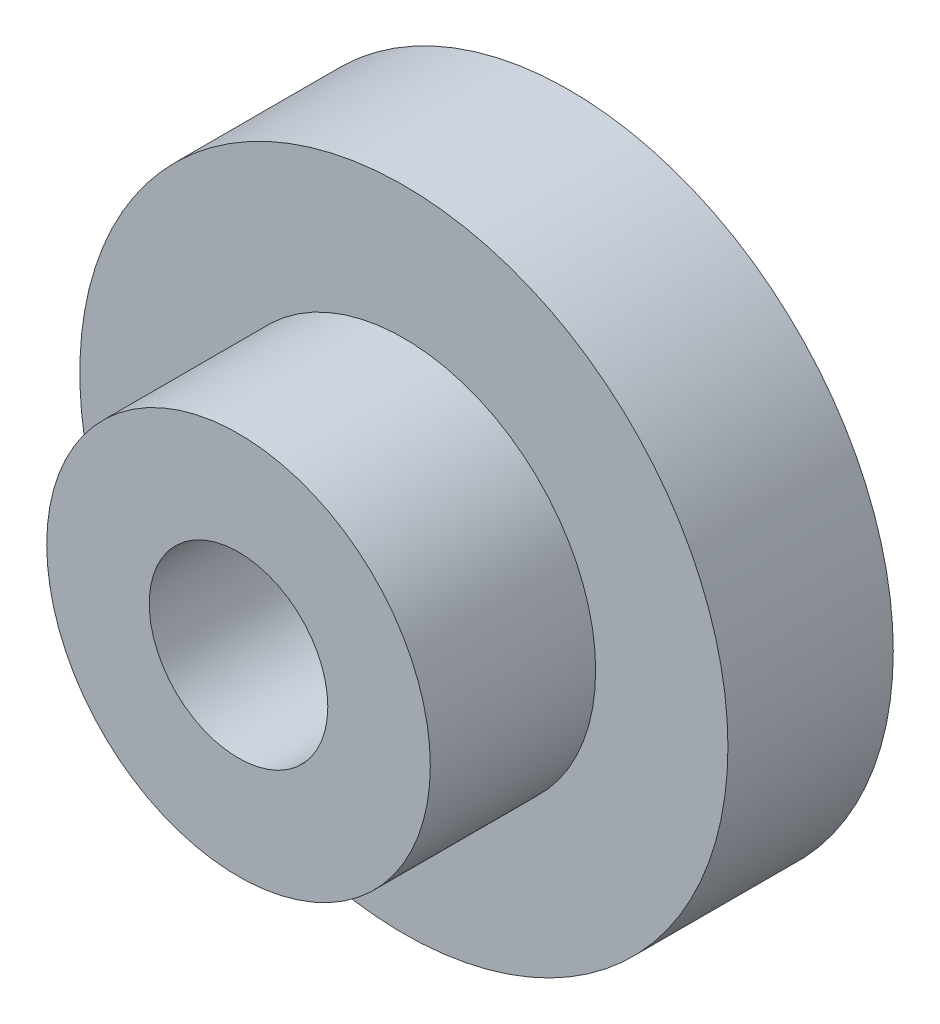
from build123d import *


with BuildPart() as part:
    # 草图1 → 旋转1 (revolve)
    with BuildSketch(Plane(origin=(0, 0, 0), x_dir=(1, 0, 0), z_dir=(0, 1, 0)), mode=Mode.PRIVATE) as revolve_1_sk:
        Polygon((-1.35, 5), (-4.9, 5), (-4.9, 2.5), (-2.9, 2.5), (-2.9, 0), (-1.35, 0), align=None)
    revolve(revolve_1_sk.sketch.rotate(Axis((0, 0, 0), (0, 0, -1)), 180), axis=Axis((0, 0, 0), (0, 0, -1)))


solid = part.part
